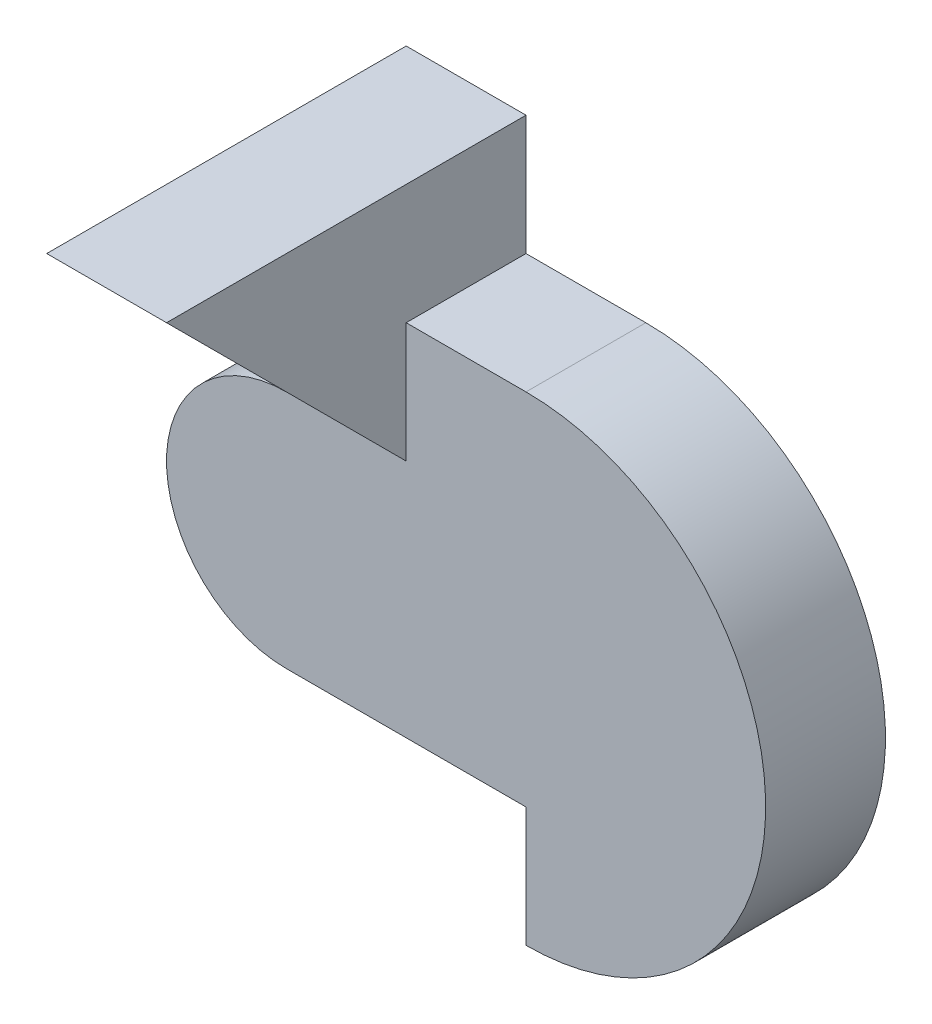
from build123d import *

# Parameters (mm, degrees)
DODANIE_WYCI_GNI_CIE1_DEPTH = 10
SZKIC2_W                    = 10
SZKIC2_H                    = 20
DODANIE_WYCI_GNI_CIE2_DEPTH = 30
WYTNIJ_WYCI_GNI_CIE1_DEPTH  = 30


with BuildPart() as part:
    # Szkic1 → Dodanie-wyciągnięcie1 (new body)
    with BuildSketch(Plane.XY):
        with BuildLine():
            Line((0, -10), (-20, -10))
            ThreePointArc((-20, -10), (-27.071067812, -7.071067812), (-30, 0))
            ThreePointArc((-30, 0), (-27.071067812, 7.071067812), (-20, 10))
            Line((-20, 10), (-10, 10))
            Line((-10, 10), (-10, 20))
            Line((-10, 20), (0, 20))
            ThreePointArc((0, 20), (20, 0), (0, -20))
            Line((0, -20), (0, -10))
        make_face()
    extrude(amount=DODANIE_WYCI_GNI_CIE1_DEPTH)

    # Szkic2 → Dodanie-wyciągnięcie2 (add)
    with BuildSketch(Plane.XY):
        with Locations((-15, 20)):
            Rectangle(SZKIC2_W, SZKIC2_H)
    extrude(amount=DODANIE_WYCI_GNI_CIE2_DEPTH)

    # Szkic3 → Wytnij-wyciągnięcie1 (cut)
    with BuildSketch(Plane(origin=(-10, 0, 0), x_dir=(0, 0, -1), z_dir=(1, 0, 0))):
        Polygon((-10, 10), (-30, 30), (-30, 10), align=None)
    extrude(amount=-WYTNIJ_WYCI_GNI_CIE1_DEPTH, mode=Mode.SUBTRACT)


solid = part.part
